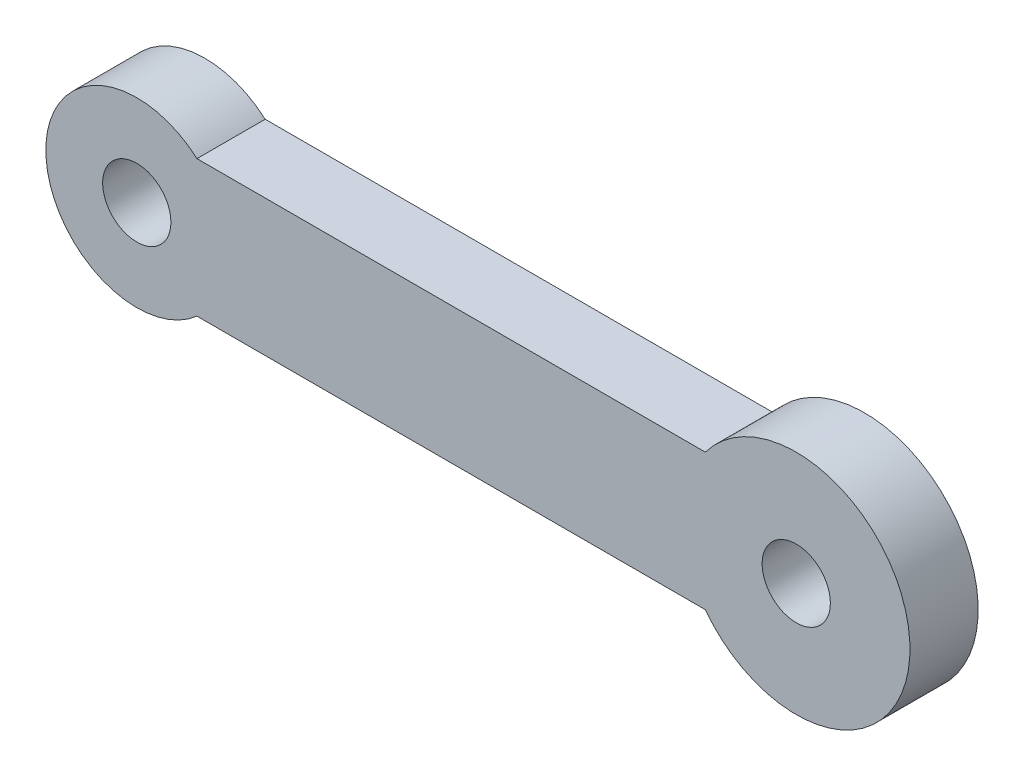
from build123d import *

# Parameters (mm, degrees)
CROQUIS1_R              = 1.5
SALIENTE_EXTRUIR1_DEPTH = 3


with BuildPart() as part:
    # Croquis1 → Saliente-Extruir1 (new body)
    with BuildSketch(Plane.XY):
        with BuildLine():
            ThreePointArc((2.645751311, 3), (-4, 0), (2.645751311, -3))
            Line((2.645751311, -3), (25, -3))
            ThreePointArc((25, -3), (34, 0), (25, 3))
            Line((25, 3), (2.645751311, 3))
        make_face()
        Circle(CROQUIS1_R, mode=Mode.SUBTRACT)
        with Locations((29, 0)):
            Circle(CROQUIS1_R, mode=Mode.SUBTRACT)
    extrude(amount=SALIENTE_EXTRUIR1_DEPTH)


solid = part.part
